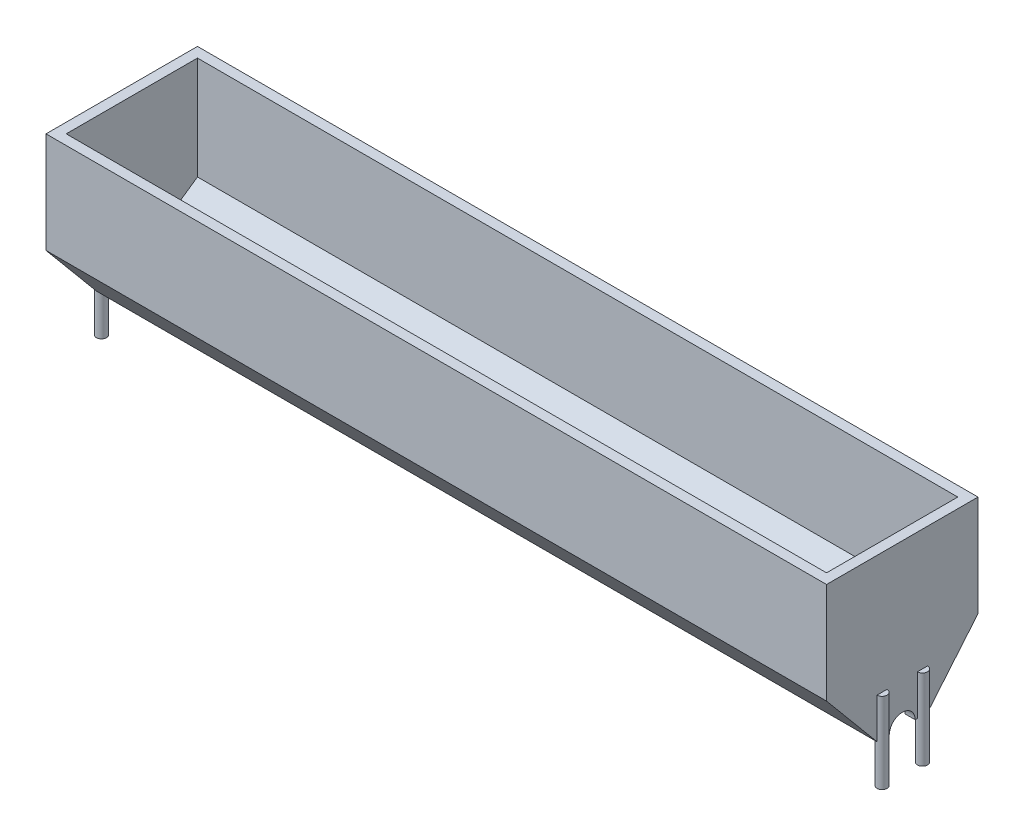
from build123d import *

# Parameters (mm, degrees)
BOSS_EXTRUDE1_DEPTH      = 2.54
BOSS_EXTRUDE2_DEPTH      = 196.342
CUT_EXTRUDE2_DEPTH       = 200.22892422
CUT_EXTRUDE2_DEPTH_BACK  = 200.22892422
SKETCH6_R                = 3.2385
SKETCH9_R                = 1.261392003
BOSS_EXTRUDE5_DEPTH      = 10.16
MIRROR11_COPY_1_SKETCH_R = 1.261392003
MIRROR11_COPY_1_DEPTH    = 10.16
BOSS_EXTRUDE6_DEPTH      = 191.262


with BuildPart() as part:
    # Sketch2 → Boss-Extrude1 (new body)
    with BuildSketch(Plane(origin=(0, 0, 0), x_dir=(0, 0, -1), z_dir=(1, 0, 0))):
        Polygon((-19.05, -12.7), (-6.35, -27.912018594), (6.35, -27.912018594), (19.05, -12.7), (19.05, 12.7), (-19.05, 12.7), align=None)
    boss_extrude1 = extrude(amount=BOSS_EXTRUDE1_DEPTH)

    # Sketch3 → Boss-Extrude2 (add)
    with BuildSketch(Plane(origin=(2.54, 0, 0), x_dir=(0, 0, -1), z_dir=(1, 0, 0))):
        Polygon((16.51, -13.202403719), (16.51, 12.7), (19.05, 12.7), (19.05, -12.7), (16.51, -15.742403719), (3.81, -24.559218594), (3.81, -22.019218594), align=None)
    boss_extrude2 = extrude(amount=-BOSS_EXTRUDE2_DEPTH)

    # Mirror1: Boss-Extrude2 across plane
    add(boss_extrude2.mirror(Plane.XY))

    # Mirror3: Boss-Extrude1 across plane
    add(boss_extrude1.mirror(Plane(origin=(-95.631, 0, 0), x_dir=(0, 0, 1), z_dir=(1, 0, 0))))

    # Sketch6 → Cut-Extrude2 (cut, two sides: drawn at the far end of the back side and taken through both)
    with BuildSketch(Plane.ZY.offset(193.802).offset(-CUT_EXTRUDE2_DEPTH_BACK)):
        with Locations((0, -27.912018594)):
            Circle(SKETCH6_R)
    extrude(amount=CUT_EXTRUDE2_DEPTH + CUT_EXTRUDE2_DEPTH_BACK, mode=Mode.SUBTRACT)

    # Sketch9 → Boss-Extrude5 (add, symmetric)
    with BuildSketch(Plane.XZ.offset(27.912018594)):
        with Locations(Location((2.54, 5.088607997, 0), (0, 0, 270))):
            Circle(SKETCH9_R)
    boss_extrude5 = extrude(amount=BOSS_EXTRUDE5_DEPTH, both=True)

    # Mirror10: Boss-Extrude5 across plane
    add(boss_extrude5.mirror(Plane(origin=(-95.631, 0, 0), x_dir=(0, 0, 1), z_dir=(1, 0, 0))))

    # Mirror11: Boss-Extrude5 across plane
    add(boss_extrude5.mirror(Plane.XY))

    # Mirror11 copy 1 sketch → Mirror11 copy 1 (add, symmetric)
    with BuildSketch(Plane(origin=(-191.262, -27.912018594, 0), x_dir=(-1, 0, 0), z_dir=(0, -1, 0))):
        with Locations(Location((2.54, 5.088607997, 0), (0, 0, 270))):
            Circle(MIRROR11_COPY_1_SKETCH_R)
    extrude(amount=MIRROR11_COPY_1_DEPTH, both=True)

    # Sketch10 → Boss-Extrude6 (add)
    with BuildSketch(Plane.ZY):
        with BuildLine():
            Line((-4.128889044, -24.337833896), (-16.51, -15.742403719))
            Line((-16.51, -15.742403719), (-6.35, -27.912018594))
            Line((-6.35, -27.912018594), (-5.461, -27.912018594))
            ThreePointArc((-5.461, -27.912018594), (-5.117146865, -26.004840322), (-4.128889044, -24.337833896))
        make_face()
    boss_extrude6 = extrude(amount=BOSS_EXTRUDE6_DEPTH)

    # Mirror12: Boss-Extrude6 across plane
    add(boss_extrude6.mirror(Plane.XY))


solid = part.part
